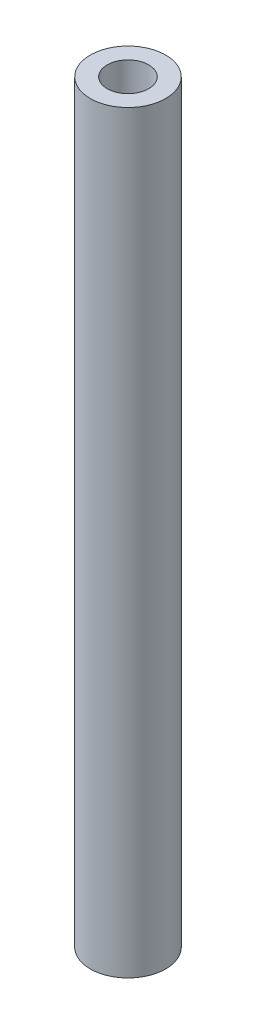
from build123d import *

# Parameters (mm, degrees)
SKETCH1_R           = 2
SKETCH1_R_2         = 1.1
BOSS_EXTRUDE1_DEPTH = 40


with BuildPart() as part:
    # Sketch1 → Boss-Extrude1 (new body)
    with BuildSketch(Plane(origin=(0, 0, 0), x_dir=(1, 0, 0), z_dir=(0, 1, 0))):
        with Locations(Location((0, 0, 0), (0, 0, 270))):
            Circle(SKETCH1_R)
        with Locations(Location((0, 0, 0), (0, 0, 270))):
            Circle(SKETCH1_R_2, mode=Mode.SUBTRACT)
    extrude(amount=BOSS_EXTRUDE1_DEPTH)


solid = part.part
